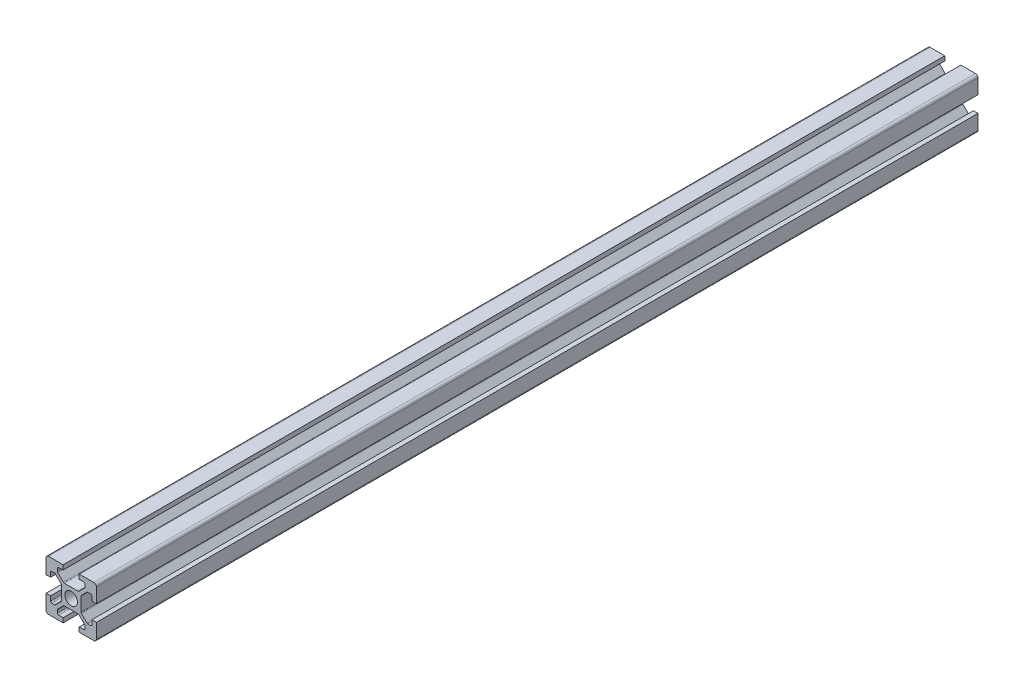
from build123d import *

# Parameters (mm, degrees)
SKETCH1_R           = 2.5
BOSS_EXTRUDE1_DEPTH = 350
FILLET1_R           = 1
FILLET2_R           = 0.5
FILLET3_R           = 0.5
FILLET4_R           = 0.5
FILLET5_R           = 0.5


with BuildPart() as part:
    # Sketch1 → Boss-Extrude1 (new body)
    with BuildSketch(Plane.XY):
        Polygon((13.2, 0), (13.2, 1.8), (15.45, 1.8), (15.45, 3.6), (12.95, 6.1), (7.05, 6.1), (4.55, 3.6), (4.55, 1.8), (6.8, 1.8), (6.8, 0), (0, 0), (0, 6.8), (1.8, 6.8), (1.8, 4.55), (3.6, 4.55), (6.1, 7.05), (6.1, 12.95), (3.6, 15.45), (1.8, 15.45), (1.8, 13.2), (0, 13.2), (0, 20), (6.8, 20), (6.8, 18.2), (4.55, 18.2), (4.55, 16.4), (7.05, 13.9), (12.95, 13.9), (15.45, 16.4), (15.45, 18.2), (13.2, 18.2), (13.2, 20), (20, 20), (20, 13.2), (18.2, 13.2), (18.2, 15.45), (16.4, 15.45), (13.9, 12.95), (13.9, 7.05), (16.4, 4.55), (18.2, 4.55), (18.2, 6.8), (20, 6.8), (20, 0), align=None)
        with Locations((10, 10)):
            Circle(SKETCH1_R, mode=Mode.SUBTRACT)
    extrude(amount=BOSS_EXTRUDE1_DEPTH)

    # Fillet1
    fillet1_edges = [part.edges().sort_by_distance(p)[0] for p in [
        (0, 0, 175),
        (0, 20, 175),
        (20, 20, 175),
        (20, 0, 175),
    ]]
    fillet(fillet1_edges, radius=FILLET1_R)

    # Fillet2
    fillet2_edges = [part.edges().sort_by_distance(p)[0] for p in [
        (4.55, 18.2, 175),
        (4.55, 16.4, 175),
        (7.05, 13.9, 175),
        (12.95, 13.9, 175),
        (15.45, 16.4, 175),
        (15.45, 18.2, 175),
    ]]
    fillet(fillet2_edges, radius=FILLET2_R)

    # Fillet3
    fillet3_edges = [part.edges().sort_by_distance(p)[0] for p in [
        (18.2, 15.45, 175),
        (16.4, 15.45, 175),
        (13.9, 12.95, 175),
        (13.9, 7.05, 175),
        (16.4, 4.55, 175),
        (18.2, 4.55, 175),
    ]]
    fillet(fillet3_edges, radius=FILLET3_R)

    # Fillet4
    fillet4_edges = [part.edges().sort_by_distance(p)[0] for p in [
        (1.8, 4.55, 175),
        (3.6, 4.55, 175),
        (6.1, 7.05, 175),
        (6.1, 12.95, 175),
        (3.6, 15.45, 175),
        (1.8, 15.45, 175),
    ]]
    fillet(fillet4_edges, radius=FILLET4_R)

    # Fillet5
    fillet5_edges = [part.edges().sort_by_distance(p)[0] for p in [
        (15.45, 1.8, 175),
        (15.45, 3.6, 175),
        (12.95, 6.1, 175),
        (7.05, 6.1, 175),
        (4.55, 3.6, 175),
        (4.55, 1.8, 175),
    ]]
    fillet(fillet5_edges, radius=FILLET5_R)


solid = part.part
